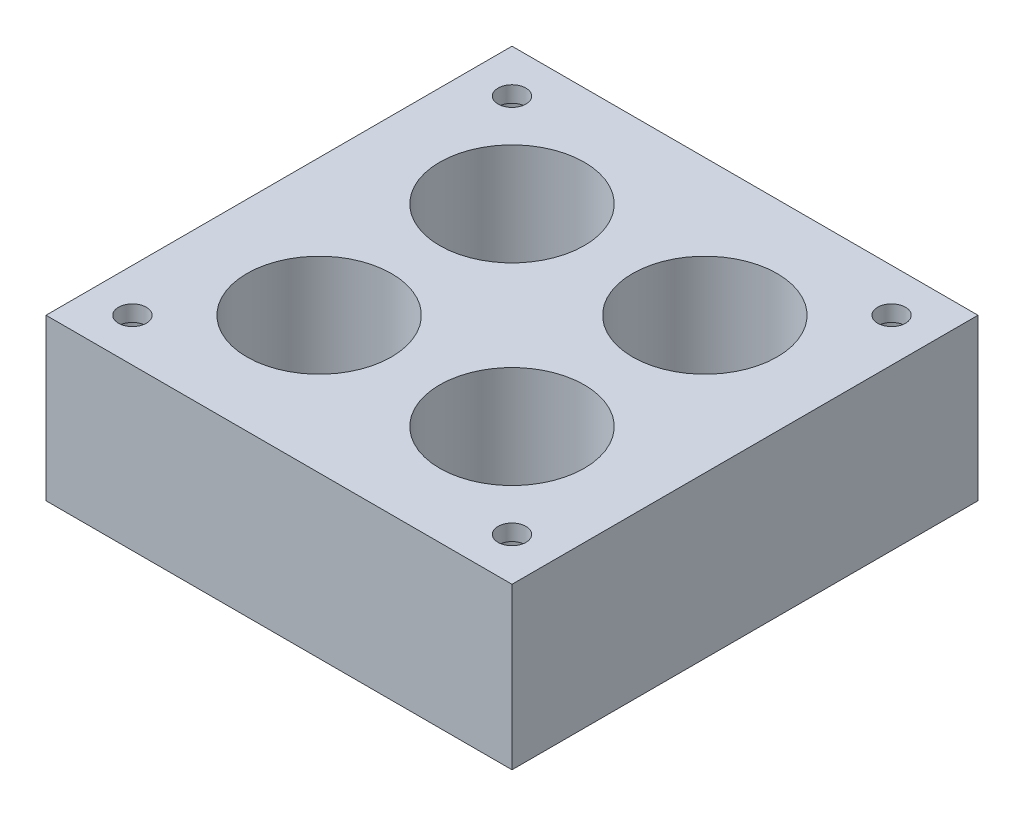
from build123d import *

# Parameters (mm, degrees)
SKETCH1_W           = 36.83
SKETCH1_H           = 36.83
SKETCH1_R           = 1.0999978
SKETCH1_R_2         = 2.159
BOSS_EXTRUDE1_DEPTH = 12.7
SKETCH2_R           = 5.715
CUT_EXTRUDE1_DEPTH  = 11.43
SKETCH3_R           = 2.54
CUT_EXTRUDE2_DEPTH  = 11.43


with BuildPart() as part:
    # Sketch1 → Boss-Extrude1 (new body)
    with BuildSketch(Plane(origin=(0, 0, 0), x_dir=(1, 0, 0), z_dir=(0, 1, 0))):
        with Locations((-1.422532637, -3.27613577)):
            Rectangle(SKETCH1_W, SKETCH1_H)
        with Locations(Location((-16.422528037, 11.72385963, 0), (0, 0, 270))):
            Circle(SKETCH1_R, mode=Mode.SUBTRACT)
        with Locations(Location((13.577462763, 11.72385963, 0), (0, 0, 90))):
            Circle(SKETCH1_R, mode=Mode.SUBTRACT)
        with Locations(Location((13.577462763, -18.27613117, 0), (0, 0, 270))):
            Circle(SKETCH1_R, mode=Mode.SUBTRACT)
        with Locations(Location((-16.422528037, -18.27613117, 0), (0, 0, 90))):
            Circle(SKETCH1_R, mode=Mode.SUBTRACT)
        with Locations(Location((-9.042532637, 4.34386423, 0), (0, 0, 270))):
            Circle(SKETCH1_R_2, mode=Mode.SUBTRACT)
        with Locations(Location((6.197467363, 4.34386423, 0), (0, 0, 90))):
            Circle(SKETCH1_R_2, mode=Mode.SUBTRACT)
        with Locations(Location((6.197467363, -10.89613577, 0), (0, 0, 270))):
            Circle(SKETCH1_R_2, mode=Mode.SUBTRACT)
        with Locations(Location((-9.042532637, -10.89613577, 0), (0, 0, 90))):
            Circle(SKETCH1_R_2, mode=Mode.SUBTRACT)
    extrude(amount=BOSS_EXTRUDE1_DEPTH)

    # Sketch2 → Cut-Extrude1 (cut)
    with BuildSketch(Plane(origin=(0, 12.7, 0), x_dir=(1, 0, 0), z_dir=(0, 1, 0))):
        with Locations(Location((-9.042532637, 4.34386423, 0), (0, 0, 270))):
            Circle(SKETCH2_R)
        with Locations(Location((6.197467363, 4.34386423, 0), (0, 0, 90))):
            Circle(SKETCH2_R)
        with Locations(Location((6.197467363, -10.89613577, 0), (0, 0, 270))):
            Circle(SKETCH2_R)
        with Locations(Location((-9.042532637, -10.89613577, 0), (0, 0, 90))):
            Circle(SKETCH2_R)
    extrude(amount=-CUT_EXTRUDE1_DEPTH, mode=Mode.SUBTRACT)

    # Sketch3 → Cut-Extrude2 (cut)
    with BuildSketch(Plane.XZ):
        with Locations(Location((-16.422528037, 18.27613117, 0), (0, 0, 270))):
            Circle(SKETCH3_R)
        with Locations(Location((13.577462763, 18.27613117, 0), (0, 0, 90))):
            Circle(SKETCH3_R)
        with Locations(Location((13.577462763, -11.72385963, 0), (0, 0, 270))):
            Circle(SKETCH3_R)
        with Locations(Location((-16.422528037, -11.72385963, 0), (0, 0, 90))):
            Circle(SKETCH3_R)
    extrude(amount=-CUT_EXTRUDE2_DEPTH, mode=Mode.SUBTRACT)


solid = part.part
